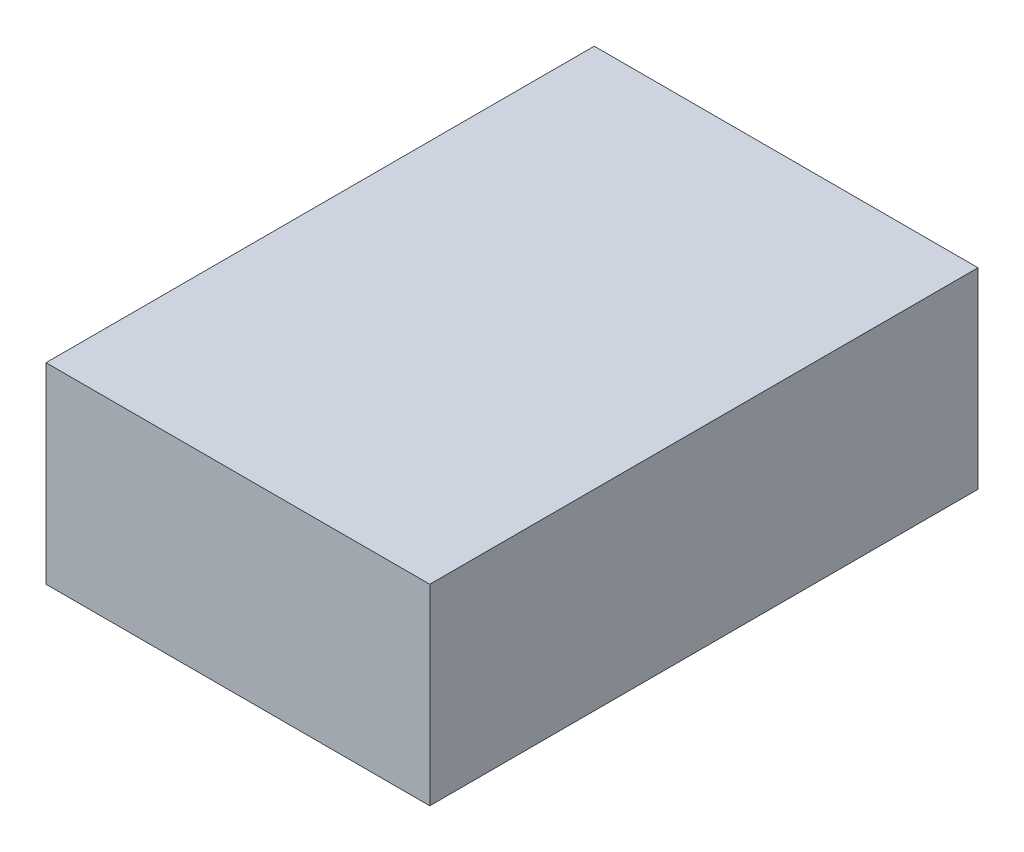
from build123d import *

# Parameters (mm, degrees)
SKETCH_1_W      = 100
SKETCH_1_H      = 35
EXTRUDE_1_DEPTH = 70


with BuildPart() as part:
    # 草图1 → 凸台-拉伸1 (new body)
    with BuildSketch(Plane(origin=(0, 0, 0), x_dir=(0, 0, -1), z_dir=(1, 0, 0))):
        with Locations((9.560067682, 19.615059222)):
            Rectangle(SKETCH_1_W, SKETCH_1_H)
    extrude(amount=EXTRUDE_1_DEPTH)


solid = part.part
